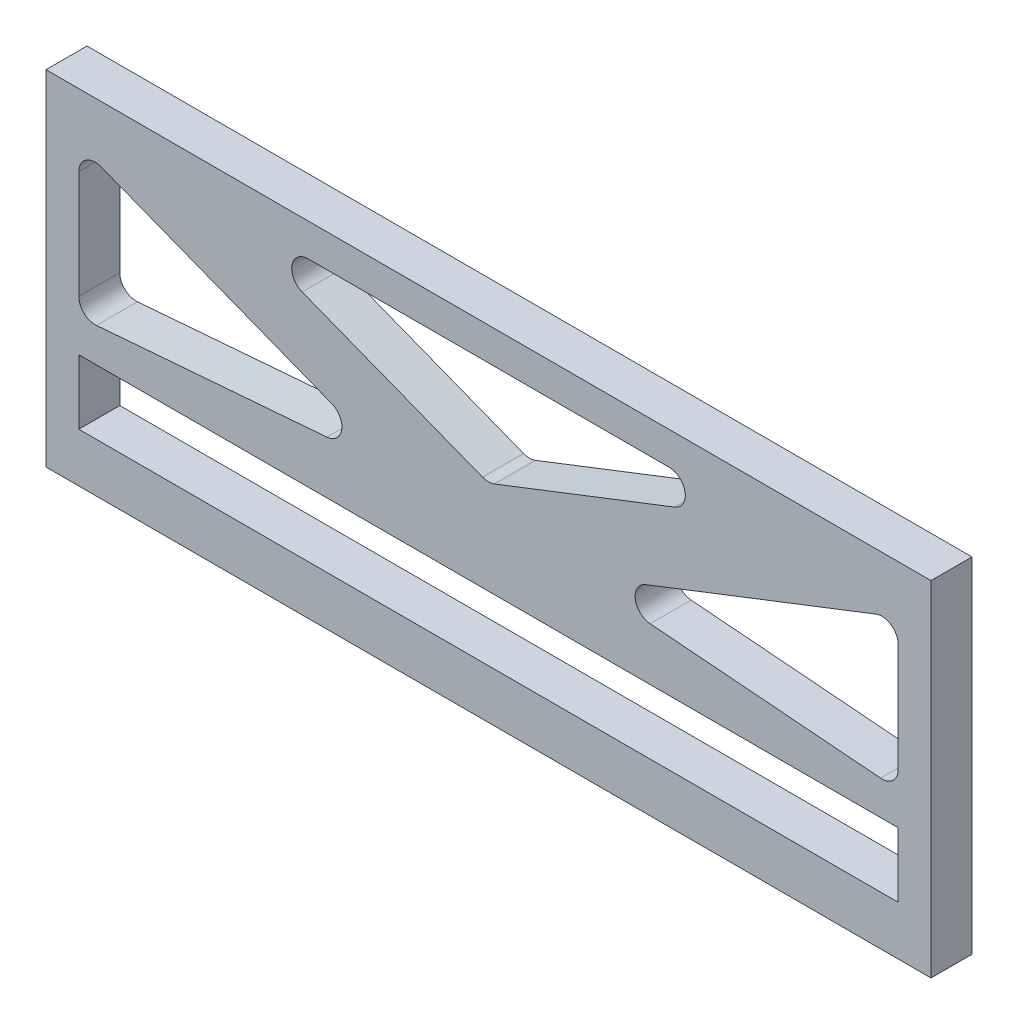
from build123d import *

# Parameters (mm, degrees)
SKETCH1_W           = 68.58
SKETCH1_H           = 26.67
SKETCH1_W_2         = 63.5
SKETCH1_H_2         = 5
BOSS_EXTRUDE1_DEPTH = 3.175
FILLET1_R           = 1.27


with BuildPart() as part:
    # Sketch1 → Boss-Extrude1 (new body)
    with BuildSketch(Plane.XY):
        Rectangle(SKETCH1_W, SKETCH1_H)
        Polygon((-20.750635985, 10.795), (0, 2.725308228), (20.750635985, 10.795), align=None, mode=Mode.SUBTRACT)
        with Locations((0, -7.025)):
            Rectangle(SKETCH1_W_2, SKETCH1_H_2, mode=Mode.SUBTRACT)
        Polygon((-31.75, 9.621913994), (-31.75, -1.985), (-7.007935444, 0), align=None, mode=Mode.SUBTRACT)
        Polygon((7.007935444, 0), (31.75, 9.621913994), (31.75, -1.985), align=None, mode=Mode.SUBTRACT)
    extrude(amount=BOSS_EXTRUDE1_DEPTH)

    # Fillet1
    fillet1_edges = [part.edges().sort_by_distance(p)[0] for p in [
        (20.750635985, 10.795, 1.5875),
        (-20.750635985, 10.795, 1.5875),
        (0, 2.725308228, 1.5875),
        (-7.007935444, 0, 1.5875),
        (-31.75, 9.621913994, 1.5875),
        (-31.75, -1.985, 1.5875),
        (7.007935444, 0, 1.5875),
        (31.75, -1.985, 1.5875),
        (31.75, 9.621913994, 1.5875),
    ]]
    fillet(fillet1_edges, radius=FILLET1_R)


solid = part.part
